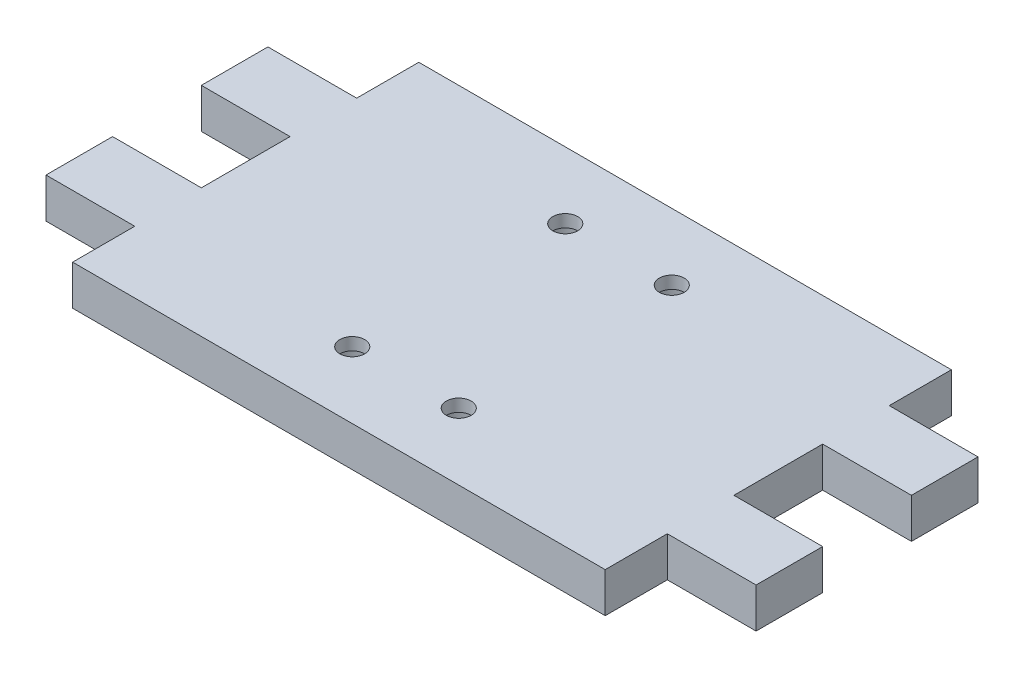
from build123d import *

# Parameters (mm, degrees)
SKETCH1_W                       = 25
SKETCH1_H                       = 4.5
BOSS_EXTRUDE1_DEPTH             = 30
SKETCH2_W                       = 7.5
SKETCH2_H                       = 4.5
BOSS_EXTRUDE2_DEPTH             = 10
ESQUISSE1_W                     = 60
ESQUISSE1_H                     = 4.5
BOSS_EXTRU_1_DEPTH              = 7
CBORE_FOR_M3_SBHCS2_D           = 2.8
CBORE_FOR_M3_SBHCS2_CBORE_D     = 5.5
CBORE_FOR_M3_SBHCS2_CBORE_DEPTH = 3.1


with BuildPart() as part:
    # Sketch1 → Boss-Extrude1 (new, symmetric)
    with BuildSketch(Plane(origin=(0, 0, 0), x_dir=(0, 0, -1), z_dir=(1, 0, 0))):
        Rectangle(SKETCH1_W, SKETCH1_H)
    extrude(amount=BOSS_EXTRUDE1_DEPTH, both=True)

    # Sketch2 → Boss-Extrude2 (add)
    with BuildSketch(Plane(origin=(30, 0, 0), x_dir=(0, 0, -1), z_dir=(1, 0, 0))):
        with Locations((-8.75, 0)):
            Rectangle(SKETCH2_W, SKETCH2_H)
        with Locations((8.75, 0)):
            Rectangle(SKETCH2_W, SKETCH2_H)
    boss_extrude2 = extrude(amount=BOSS_EXTRUDE2_DEPTH)

    # Esquisse1 → Boss.-Extru.1 (add)
    with BuildSketch(Plane.XY.offset(12.5)):
        Rectangle(ESQUISSE1_W, ESQUISSE1_H)
    boss_extru_1 = extrude(amount=BOSS_EXTRU_1_DEPTH)

    # Symétrie1: Boss.-Extru.1 across plane
    add(boss_extru_1.mirror(Plane.XY))

    # Mirror1: Boss-Extrude2 across plane
    add(boss_extrude2.mirror(Plane(origin=(0, 0, 0), x_dir=(0, 0, 1), z_dir=(1, 0, 0))))

    # CBORE for M3 SBHCS2 (through all)
    with Locations(Plane(origin=(0, -2.25, 0), x_dir=(-1, 0, 0), z_dir=(0, -1, 0))):
        with Locations((-6, 12), (6, 12), (6, -12), (-6, -12)):
            CounterBoreHole(CBORE_FOR_M3_SBHCS2_D / 2, CBORE_FOR_M3_SBHCS2_CBORE_D / 2, CBORE_FOR_M3_SBHCS2_CBORE_DEPTH)


solid = part.part
